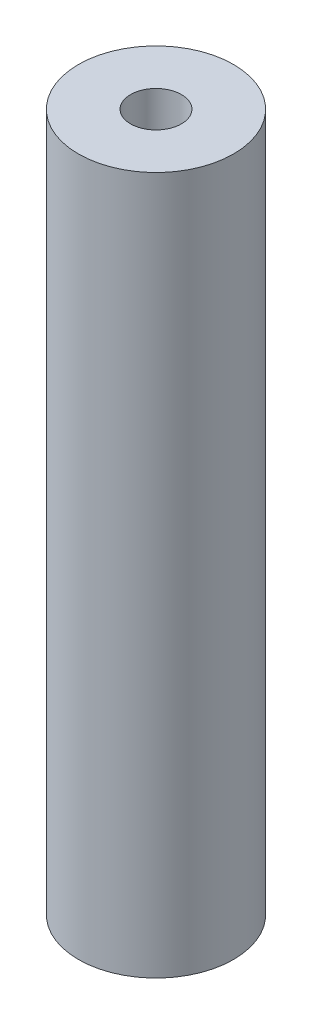
from build123d import *

# Parameters (mm, degrees)
SKETCH_1_R      = 4.725
SKETCH_1_R_2    = 1.55
EXTRUDE_1_DEPTH = 42.5


with BuildPart() as part:
    # 草图1 → 凸台-拉伸1 (new body)
    with BuildSketch(Plane(origin=(0, 0, 0), x_dir=(1, 0, 0), z_dir=(0, 1, 0))):
        with Locations(Location((0, 0, 0), (0, 0, 270))):
            Circle(SKETCH_1_R)
        with Locations(Location((0, 0, 0), (0, 0, 270))):
            Circle(SKETCH_1_R_2, mode=Mode.SUBTRACT)
    extrude(amount=EXTRUDE_1_DEPTH)


solid = part.part
